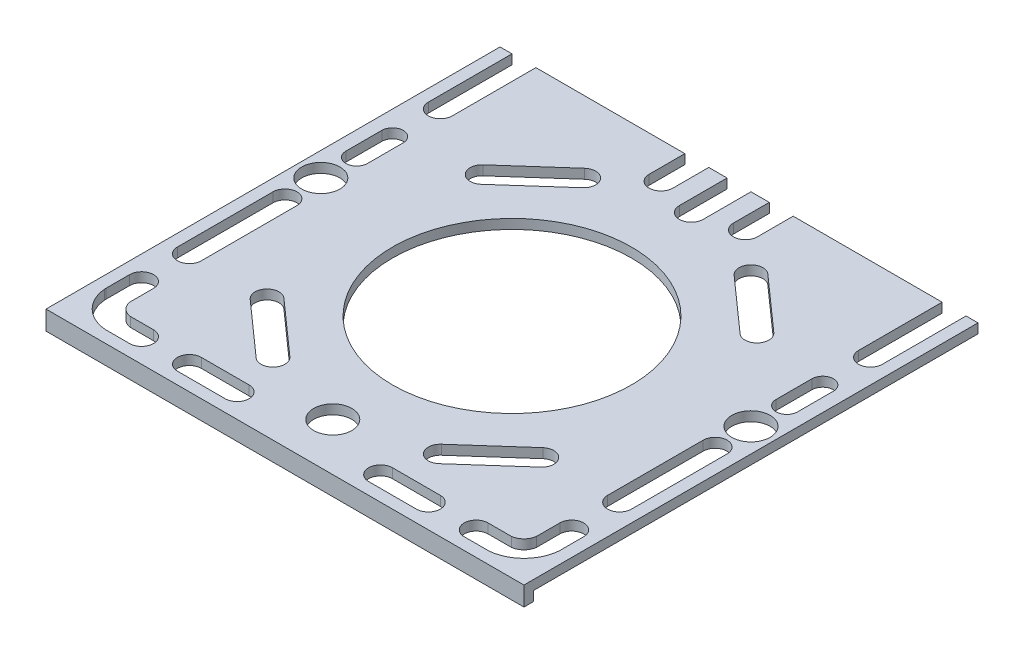
from build123d import *

# Parameters (mm, degrees)
SKETCH1_W           = 200
SKETCH1_H           = 190
BOSS_EXTRUDE1_DEPTH = 4
SKETCH3_R           = 50
CUT_EXTRUDE5_DEPTH  = 10
SKETCH4_W           = 200
SKETCH4_H           = 4
BOSS_EXTRUDE2_DEPTH = 4
SKETCH_1_R          = 8
CUT_EXTRUDE_1_DEPTH = 10


with BuildPart() as part:
    # Sketch1 → Boss-Extrude1 (new body)
    with BuildSketch(Plane(origin=(0, 0, 0), x_dir=(1, 0, 0), z_dir=(0, 1, 0))):
        with Locations((100, 95)):
            Rectangle(SKETCH1_W, SKETCH1_H)
    extrude(amount=BOSS_EXTRUDE1_DEPTH)

    # Sketch3 → Cut-Extrude5 (cut)
    with BuildSketch(Plane(origin=(0, 4, 0), x_dir=(1, 0, 0), z_dir=(0, 1, 0))):
        with BuildLine():
            Line((30, 15), (20.262068061, 15))
            ThreePointArc((20.262068061, 15), (16.735494747, 16.716132106), (15, 20.233217082))
            Line((15, 20.233217082), (15, 30))
            ThreePointArc((15, 30), (10, 35), (5, 30))
            Line((5, 30), (5, 20.194837008))
            ThreePointArc((5, 20.194837008), (4.997925704, 19.868737095), (5.017113168, 19.54319555))
            ThreePointArc((5.017113168, 19.54319555), (9.654794827, 9.654664453), (19.545086076, 5.020737673))
            ThreePointArc((19.545086076, 5.020737673), (19.772306824, 5.005187109), (20, 5))
            Line((20, 5), (30, 5))
            ThreePointArc((30, 5), (35, 10), (30, 15))
        make_face()
        with BuildLine():
            Line((5, 90), (5, 50))
            ThreePointArc((5, 50), (10, 45), (15, 50))
            Line((15, 50), (15, 90))
            ThreePointArc((15, 90), (10, 95), (5, 90))
        make_face()
        with BuildLine():
            Line((70, 15), (50, 15))
            ThreePointArc((50, 15), (45, 10), (50, 5))
            Line((50, 5), (70, 5))
            ThreePointArc((70, 5), (75, 10), (70, 15))
        make_face()
        with BuildLine():
            ThreePointArc((185, 50), (190, 45), (195, 50))
            Line((195, 50), (195, 90))
            ThreePointArc((195, 90), (190, 95), (185, 90))
            Line((185, 90), (185, 50))
        make_face()
        with BuildLine():
            ThreePointArc((185, 20.233217082), (183.264505253, 16.716132106), (179.737931939, 15))
            Line((179.737931939, 15), (170, 15))
            ThreePointArc((170, 15), (165, 10), (170, 5))
            Line((170, 5), (180, 5))
            ThreePointArc((180, 5), (180.227693176, 5.005187109), (180.454913924, 5.020737673))
            ThreePointArc((180.454913924, 5.020737673), (190.345205173, 9.654664453), (194.982886832, 19.54319555))
            ThreePointArc((194.982886832, 19.54319555), (195.002074296, 19.868737095), (195, 20.194837008))
            Line((195, 20.194837008), (195, 30))
            ThreePointArc((195, 30), (190, 35), (185, 30))
            Line((185, 30), (185, 20.233217082))
        make_face()
        with BuildLine():
            ThreePointArc((150, 5), (155, 10), (150, 15))
            Line((150, 15), (130, 15))
            ThreePointArc((130, 15), (125, 10), (130, 5))
            Line((130, 5), (150, 5))
        make_face()
        with BuildLine():
            ThreePointArc((160.821819194, 46.262953407), (161.237046593, 53.321819194), (154.178180806, 53.737046593))
            Line((154.178180806, 53.737046593), (131.678180806, 33.737046593))
            ThreePointArc((131.678180806, 33.737046593), (131.262953407, 26.678180806), (138.321819194, 26.262953407))
            Line((138.321819194, 26.262953407), (160.821819194, 46.262953407))
        make_face()
        with BuildLine():
            Line((131.678180806, 156.262953407), (154.178180806, 136.262953407))
            ThreePointArc((154.178180806, 136.262953407), (161.237046593, 136.678180806), (160.821819194, 143.737046593))
            Line((160.821819194, 143.737046593), (138.321819194, 163.737046593))
            ThreePointArc((138.321819194, 163.737046593), (131.262953407, 163.321819194), (131.678180806, 156.262953407))
        make_face()
        with BuildLine():
            Line((5.5, 135), (5.5, 120))
            ThreePointArc((5.5, 120), (10, 115.5), (14.5, 120))
            Line((14.5, 120), (14.5, 135))
            ThreePointArc((14.5, 135), (10, 139.5), (5.5, 135))
        make_face()
        with BuildLine():
            ThreePointArc((39.178180806, 143.737046593), (38.762953407, 136.678180806), (45.821819194, 136.262953407))
            Line((45.821819194, 136.262953407), (68.321819194, 156.262953407))
            ThreePointArc((68.321819194, 156.262953407), (68.737046593, 163.321819194), (61.678180806, 163.737046593))
            Line((61.678180806, 163.737046593), (39.178180806, 143.737046593))
        make_face()
        with BuildLine():
            Line((68.321819194, 33.737046593), (45.821819194, 53.737046593))
            ThreePointArc((45.821819194, 53.737046593), (38.762953407, 53.321819194), (39.178180806, 46.262953407))
            Line((39.178180806, 46.262953407), (61.678180806, 26.262953407))
            ThreePointArc((61.678180806, 26.262953407), (68.737046593, 26.678180806), (68.321819194, 33.737046593))
        make_face()
        with BuildLine():
            Line((95, 190), (95, 170))
            ThreePointArc((95, 170), (100, 165), (105, 170))
            Line((105, 170), (105, 190))
            ThreePointArc((105, 190), (100, 195), (95, 190))
        make_face()
        with BuildLine():
            Line((77.335483589, 190), (77.335483589, 175))
            ThreePointArc((77.335483589, 175), (82.335483589, 170), (87.335483589, 175))
            Line((87.335483589, 175), (87.335483589, 190))
            ThreePointArc((87.335483589, 190), (82.335483589, 195), (77.335483589, 190))
        make_face()
        with BuildLine():
            Line((5, 207.20463147), (5, 155))
            ThreePointArc((5, 155), (10, 150), (15, 155))
            Line((15, 155), (15, 207.20463147))
            ThreePointArc((15, 207.20463147), (10, 212.20463147), (5, 207.20463147))
        make_face()
        with BuildLine():
            ThreePointArc((185, 155), (190, 150), (195, 155))
            Line((195, 155), (195, 207.20463147))
            ThreePointArc((195, 207.20463147), (190, 212.20463147), (185, 207.20463147))
            Line((185, 207.20463147), (185, 155))
        make_face()
        with BuildLine():
            ThreePointArc((112.664516411, 175), (117.664516411, 170), (122.664516411, 175))
            Line((122.664516411, 175), (122.664516411, 190))
            ThreePointArc((122.664516411, 190), (117.664516411, 195), (112.664516411, 190))
            Line((112.664516411, 190), (112.664516411, 175))
        make_face()
        with BuildLine():
            ThreePointArc((185.5, 120), (190, 115.5), (194.5, 120))
            Line((194.5, 120), (194.5, 135))
            ThreePointArc((194.5, 135), (190, 139.5), (185.5, 135))
            Line((185.5, 135), (185.5, 120))
        make_face()
        with Locations((100, 95)):
            Circle(SKETCH3_R)
    extrude(amount=-CUT_EXTRUDE5_DEPTH, mode=Mode.SUBTRACT)

    # Sketch4 → Boss-Extrude2 (add)
    with BuildSketch(Plane.XZ):
        with Locations((100, -2)):
            Rectangle(SKETCH4_W, SKETCH4_H)
    extrude(amount=BOSS_EXTRUDE2_DEPTH)

    # ｽｹｯﾁ1 → ｶｯﾄ - 押し出し1 (cut)
    with BuildSketch(Plane(origin=(0, 4, 0), x_dir=(1, 0, 0), z_dir=(0, 1, 0))):
        with Locations((100, 20)):
            Circle(SKETCH_1_R)
        with Locations((190, 105)):
            Circle(SKETCH_1_R)
        with Locations((10, 105)):
            Circle(SKETCH_1_R)
    extrude(amount=-CUT_EXTRUDE_1_DEPTH, mode=Mode.SUBTRACT)


solid = part.part
